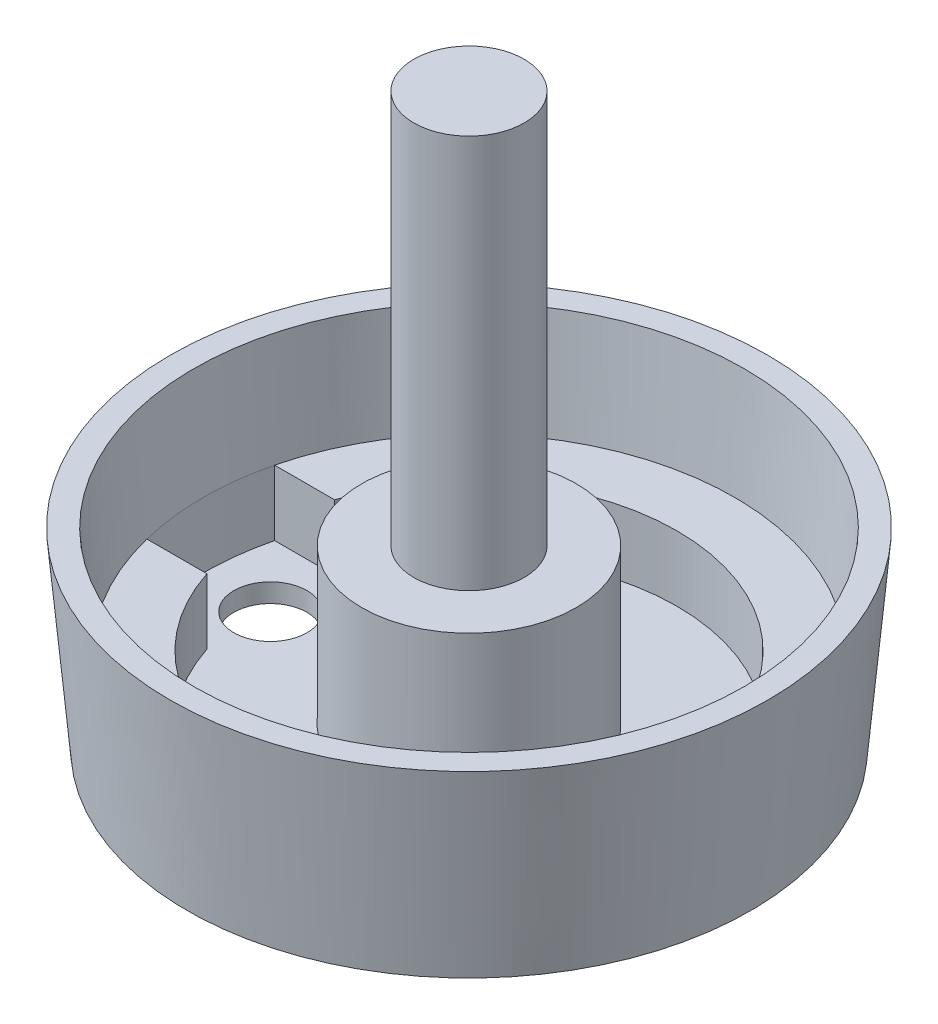
from build123d import *

# Parameters (mm, degrees)
SKETCH2_R           = 3.175
SKETCH2_R_2         = 5.9817
CUT_EXTRUDE1_DEPTH  = 76.878222264
CUT_EXTRUDE3_DEPTH  = 10.6934
SKETCH5_W           = 19.304
SKETCH5_H           = 37.8079
BOSS_EXTRUDE1_DEPTH = 12.4587
SKETCH6_R           = 17.5641
BOSS_EXTRUDE2_DEPTH = 25.6032
SKETCH7_R           = 9.03605
BOSS_EXTRUDE3_DEPTH = 64.4271
CUT_EXTRUDE2_DEPTH  = 1.524


with BuildPart() as part:
    # Sketch1 → Revolve1 (revolve)
    with BuildSketch(Plane.XY, mode=Mode.PRIVATE) as revolve1_sk:
        Polygon((0, 0), (-46.101, 0), (-48.895, 31.242), (-45.0572124, 31.242), (-43.495525408, 13.7795), (0, 13.7795), align=None)
    revolve(revolve1_sk.sketch.rotate(Axis((0, 0, 0), (0, 1, 0)), 270), axis=Axis((0, 0, 0), (0, 1, 0)))

    # Sketch2 → Cut-Extrude1 (cut, through all)
    with BuildSketch(Plane.XZ):
        with Locations(Location((16.891, 0, 0), (0, 0, 270))):
            Circle(SKETCH2_R)
        with Locations(Location((-32.4993, 0, 0), (0, 0, 270))):
            Circle(SKETCH2_R_2)
    extrude(amount=-CUT_EXTRUDE1_DEPTH, mode=Mode.SUBTRACT)

    # Sketch4 → Cut-Extrude3 (cut)
    with BuildSketch(Plane(origin=(0, 13.7795, 0), x_dir=(1, 0, 0), z_dir=(0, 1, 0))):
        with BuildLine():
            Line((-32.372904727, -10.50925), (-42.206828772, -10.50925))
            ThreePointArc((-42.206828772, -10.50925), (-43.495497734, -0.049065379), (-42.23043138, 10.414))
            Line((-42.23043138, 10.414), (-32.403671088, 10.414))
            ThreePointArc((-32.403671088, 10.414), (34.035963204, 0.050047806), (-32.372904727, -10.50925))
        make_face()
    extrude(amount=-CUT_EXTRUDE3_DEPTH, mode=Mode.SUBTRACT)

    # Sketch5 → Boss-Extrude1 (add)
    with BuildSketch(Plane.XZ):
        Rectangle(SKETCH5_W, SKETCH5_H)
    extrude(amount=BOSS_EXTRUDE1_DEPTH)

    # Sketch6 → Boss-Extrude2 (add)
    with BuildSketch(Plane(origin=(0, 3.0861, 0), x_dir=(1, 0, 0), z_dir=(0, 1, 0))):
        with Locations(Location((0, 0, 0), (0, 0, 10.335443893))):
            Circle(SKETCH6_R)
    extrude(amount=BOSS_EXTRUDE2_DEPTH)

    # Sketch7 → Boss-Extrude3 (add)
    with BuildSketch(Plane(origin=(0, 28.6893, 0), x_dir=(1, 0, 0), z_dir=(0, 1, 0))):
        with Locations(Location((0, 0, 0), (0, 0, 270))):
            Circle(SKETCH7_R)
    extrude(amount=BOSS_EXTRUDE3_DEPTH)

    # Sketch3 → Cut-Extrude2 (cut)
    with BuildSketch(Plane(origin=(0, 3.0861, 0), x_dir=(1, 0, 0), z_dir=(0, 1, 0))):
        Polygon((22.44725, -3.207902433), (22.44725, 3.207902433), (16.891, 6.415804866), (11.33475, 3.207902433), (11.33475, -3.207902433), (16.891, -6.415804866), align=None)
    extrude(amount=-CUT_EXTRUDE2_DEPTH, mode=Mode.SUBTRACT)


solid = part.part
